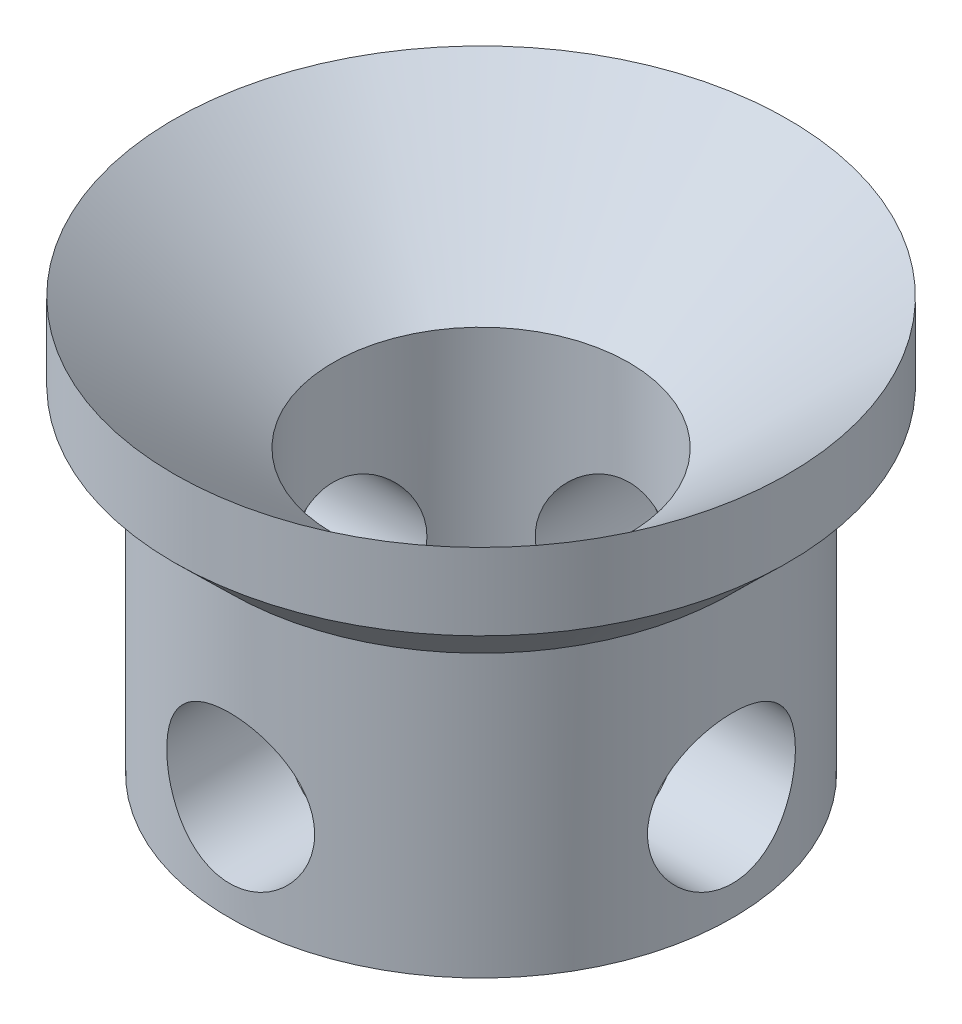
from build123d import *

# Parameters (mm, degrees)
SKETCH9_R          = 25
CUT_EXTRUDE1_DEPTH = 100
SKETCH10_R         = 25
CUT_EXTRUDE2_DEPTH = 100
SKETCH11_R         = 149.836280288
SKETCH11_R_2       = 103.82223994
CUT_EXTRUDE3_DEPTH = 265.609047568


with BuildPart() as part:
    # Sketch5 → Revolve3 (revolve)
    with BuildSketch(Plane.XY):
        Polygon((-85.003274394, 95.088408644), (-85.003274394, 0), (-50, 0), (-50, 95.088408644), (-127.045813647, 158.480681074), (-149.836280288, 158.480681074), align=None)
    revolve(axis=Axis((0, -87.884741323, 0), (0, 1, 0)))

    # Sketch9 → Cut-Extrude1 (cut, symmetric)
    with BuildSketch(Plane.XY):
        with Locations((0, 35.088408644)):
            Circle(SKETCH9_R)
    extrude(amount=CUT_EXTRUDE1_DEPTH, both=True, mode=Mode.SUBTRACT)

    # Sketch10 → Cut-Extrude2 (cut, symmetric)
    with BuildSketch(Plane(origin=(0, 0, 0), x_dir=(0, 0, -1), z_dir=(1, 0, 0))):
        with Locations((0, 35.088408644)):
            Circle(SKETCH10_R)
    extrude(amount=CUT_EXTRUDE2_DEPTH, both=True, mode=Mode.SUBTRACT)

    # Sketch11 → Cut-Extrude3 (cut, through all)
    with BuildSketch(Plane.XZ):
        Circle(SKETCH11_R)
        Circle(SKETCH11_R_2, mode=Mode.SUBTRACT)
    extrude(amount=-CUT_EXTRUDE3_DEPTH, mode=Mode.SUBTRACT)


solid = part.part
